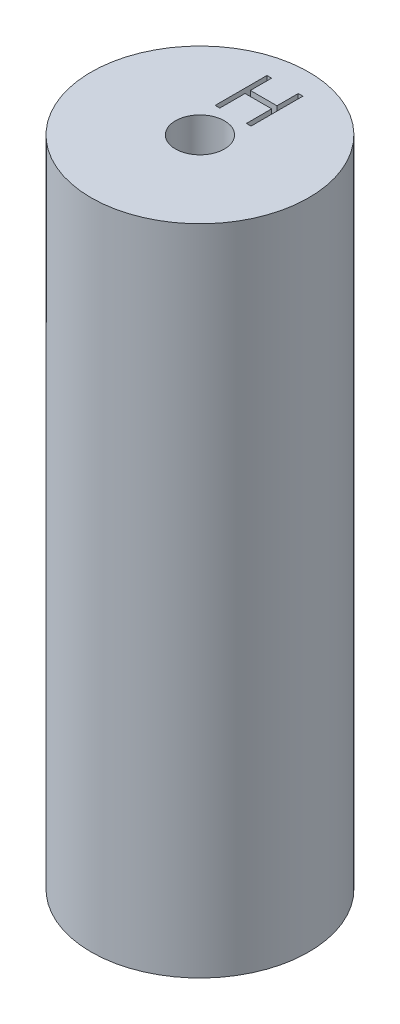
from build123d import *

# Parameters (mm, degrees)
SKETCH1_R           = 10
BOSS_EXTRUDE1_DEPTH = 4
SKETCH2_R           = 10
SKETCH2_R_2         = 8
SKETCH2_R_3         = 3.5
BOSS_EXTRUDE2_DEPTH = 52
SKETCH3_R           = 10
BOSS_EXTRUDE3_DEPTH = 4
CUT_EXTRUDE1_DEPTH  = 2
SKETCH5_R           = 2.25
CUT_EXTRUDE2_DEPTH  = 50


with BuildPart() as part:
    # Sketch1 → Boss-Extrude1 (new body)
    with BuildSketch(Plane(origin=(0, 0, 0), x_dir=(1, 0, 0), z_dir=(0, 1, 0))):
        with Locations(Location((0, 0, 0), (0, 0, 270))):
            Circle(SKETCH1_R)
    extrude(amount=BOSS_EXTRUDE1_DEPTH)

    # Sketch2 → Boss-Extrude2 (add)
    # profile 1 of 2: a face of its own
    with BuildSketch(Plane(origin=(0, 4, 0), x_dir=(1, 0, 0), z_dir=(0, 1, 0))):
        with Locations(Location((0, 0, 0), (0, 0, 270))):
            Circle(SKETCH2_R)
        with Locations(Location((0, 0, 0), (0, 0, 90))):
            Circle(SKETCH2_R_2, mode=Mode.SUBTRACT)
    # profile 2 of 2: a face of its own
    with BuildSketch(Plane(origin=(0, 4, 0), x_dir=(1, 0, 0), z_dir=(0, 1, 0))):
        with Locations(Location((0, 0, 0), (0, 0, 90))):
            Circle(SKETCH2_R_3)
    extrude(amount=BOSS_EXTRUDE2_DEPTH)

    # Sketch3 → Boss-Extrude3 (add)
    with BuildSketch(Plane(origin=(0, 56, 0), x_dir=(1, 0, 0), z_dir=(0, 1, 0))):
        with Locations(Location((0, 0, 0), (0, 0, 270))):
            Circle(SKETCH3_R)
    extrude(amount=BOSS_EXTRUDE3_DEPTH)

    # Sketch4 → Cut-Extrude1 (cut)
    with BuildSketch(Plane(origin=(0, 60, 0), x_dir=(1, 0, 0), z_dir=(0, 1, 0))):
        Polygon((-1.648557692, 7.80697224), (-1.221153846, 7.80697224), (-1.221153846, 5.853126086), (1.221153846, 5.853126086), (1.221153846, 7.80697224), (1.648557692, 7.80697224), (1.648557692, 3.04447224), (1.221153846, 3.04447224), (1.221153846, 5.364664548), (-1.221153846, 5.364664548), (-1.221153846, 3.04447224), (-1.648557692, 3.04447224), align=None)
    extrude(amount=-CUT_EXTRUDE1_DEPTH, mode=Mode.SUBTRACT)

    # Sketch5 → Cut-Extrude2 (cut)
    with BuildSketch(Plane(origin=(0, 60, 0), x_dir=(1, 0, 0), z_dir=(0, 1, 0))):
        with Locations(Location((0, 0, 0), (0, 0, 270))):
            Circle(SKETCH5_R)
    extrude(amount=-CUT_EXTRUDE2_DEPTH, mode=Mode.SUBTRACT)


solid = part.part
